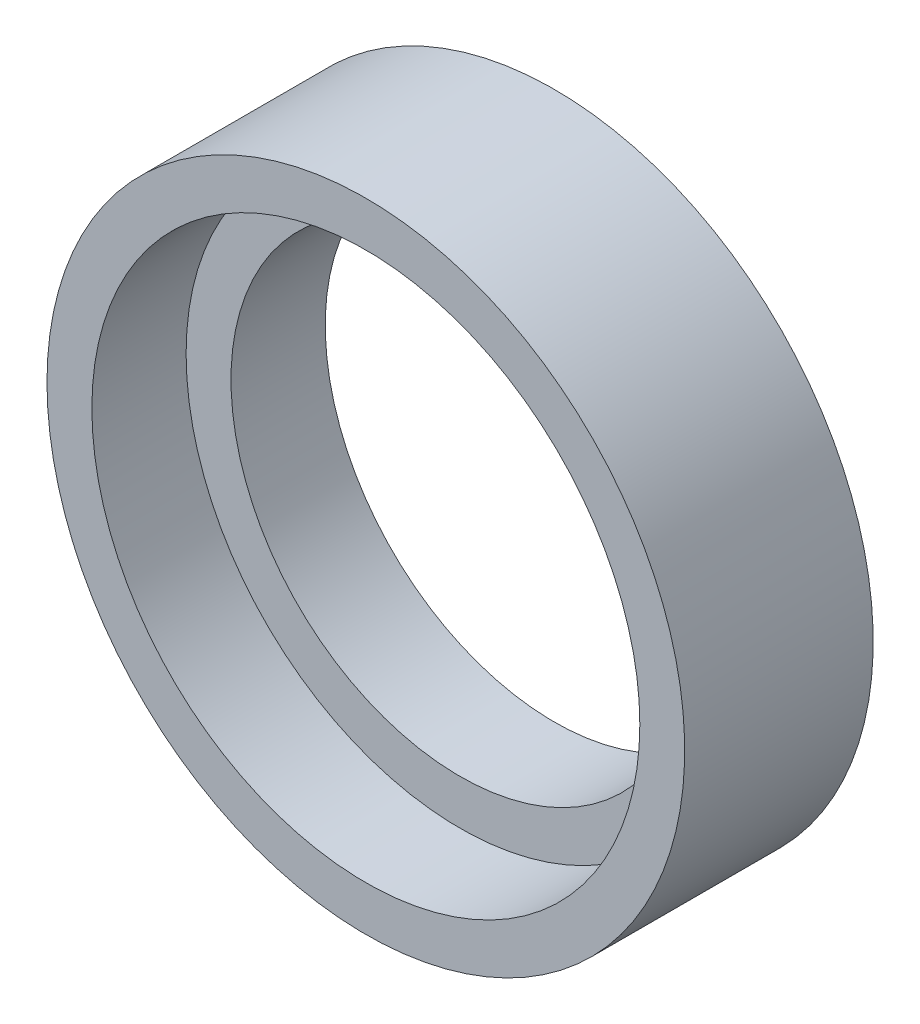
from build123d import *

# Parameters (mm, degrees)
SKETCH1_R           = 71.05
SKETCH1_R_2         = 61.05
BOSS_EXTRUDE1_DEPTH = 21
BOSS_EXTRUDE2_START = 21
SKETCH2_R           = 71.05
SKETCH2_R_2         = 51.05
BOSS_EXTRUDE2_DEPTH = 21


with BuildPart() as part:
    # Sketch1 → Boss-Extrude1 (new body)
    with BuildSketch(Plane.XY):
        with Locations(Location((0, 0, 0), (0, 0, 180))):
            Circle(SKETCH1_R)
        with Locations(Location((0, 0, 0), (0, 0, 180))):
            Circle(SKETCH1_R_2, mode=Mode.SUBTRACT)
    extrude(amount=BOSS_EXTRUDE1_DEPTH)

    # Sketch2 → Boss-Extrude2 (add)
    with BuildSketch(Plane(origin=(0, 0, 0), x_dir=(-1, 0, 0), z_dir=(0, 0, -1)).offset(BOSS_EXTRUDE2_START)):
        Circle(SKETCH2_R)
        with Locations(Location((0, 0, 0), (0, 0, 180))):
            Circle(SKETCH2_R_2, mode=Mode.SUBTRACT)
    extrude(amount=-BOSS_EXTRUDE2_DEPTH)


solid = part.part
